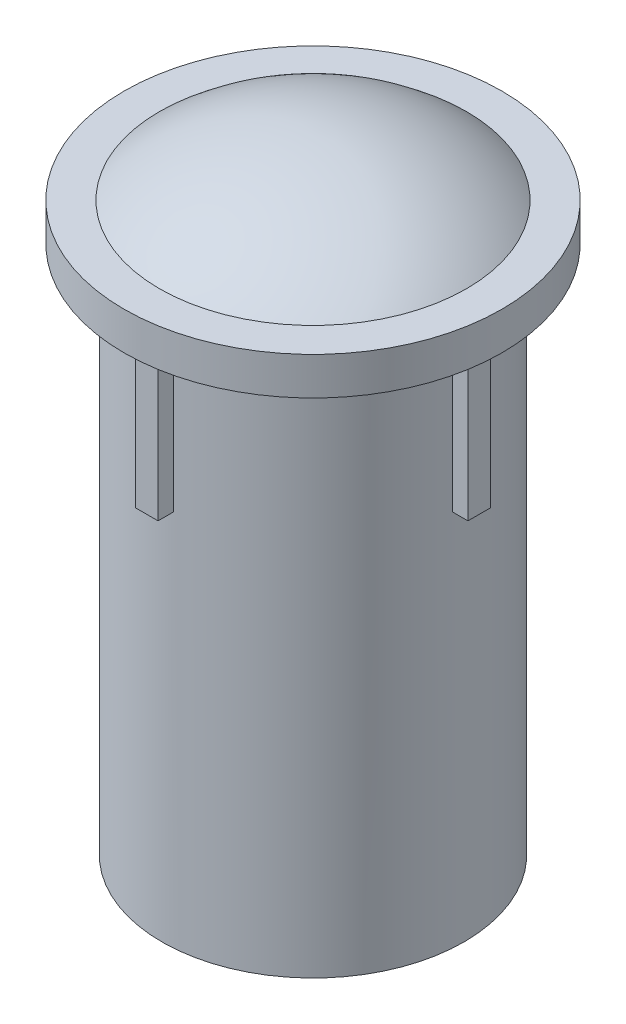
from build123d import *

# Parameters (mm, degrees)
SKETCH_1_R      = 2.5
EXTRUDE_1_DEPTH = 0.5
SKETCH_4_R      = 2
EXTRUDE_2_DEPTH = 7
SKETCH_5_W      = 0.3
SKETCH_5_H      = 0.29255476
SKETCH_5_W_2    = 0.29255476
SKETCH_5_H_2    = 0.3
EXTRUDE_3_DEPTH = 2


with BuildPart() as part:
    # 草图1 → 凸台-拉伸1 (new body)
    with BuildSketch(Plane(origin=(0, 0, 0), x_dir=(1, 0, 0), z_dir=(0, 1, 0))):
        with Locations(Location((0, 0, 0), (0, 0, 270))):
            Circle(SKETCH_1_R)
    extrude(amount=EXTRUDE_1_DEPTH)

    # 草图2 → 旋转4 (revolve)
    with BuildSketch(Plane.XY):
        with BuildLine():
            Line((2.5, 0), (0, 0))
            Line((0, 0), (0, 1.25))
            ThreePointArc((0, 1.25), (1.397542486, 0.920084972), (2.5, 0))
        make_face()
    revolve(axis=Axis((0, 3.671150215, 0), (0, -1, 0)))

    # 草图4 → 凸台-拉伸2 (add)
    with BuildSketch(Plane.XZ):
        with Locations(Location((0, 0, 0), (0, 0, 90))):
            Circle(SKETCH_4_R)
    extrude(amount=EXTRUDE_2_DEPTH)

    # 草图5 → 凸台-拉伸3 (add)
    with BuildSketch(Plane.XZ):
        with Locations((0, 2.05372262)):
            Rectangle(SKETCH_5_W, SKETCH_5_H)
        with Locations((-2.05372262, 0)):
            Rectangle(SKETCH_5_W_2, SKETCH_5_H_2)
        with Locations((2.05372262, 0)):
            Rectangle(SKETCH_5_W_2, SKETCH_5_H_2)
        with Locations((0, -2.05372262)):
            Rectangle(SKETCH_5_W, SKETCH_5_H)
    extrude(amount=EXTRUDE_3_DEPTH)


solid = part.part
